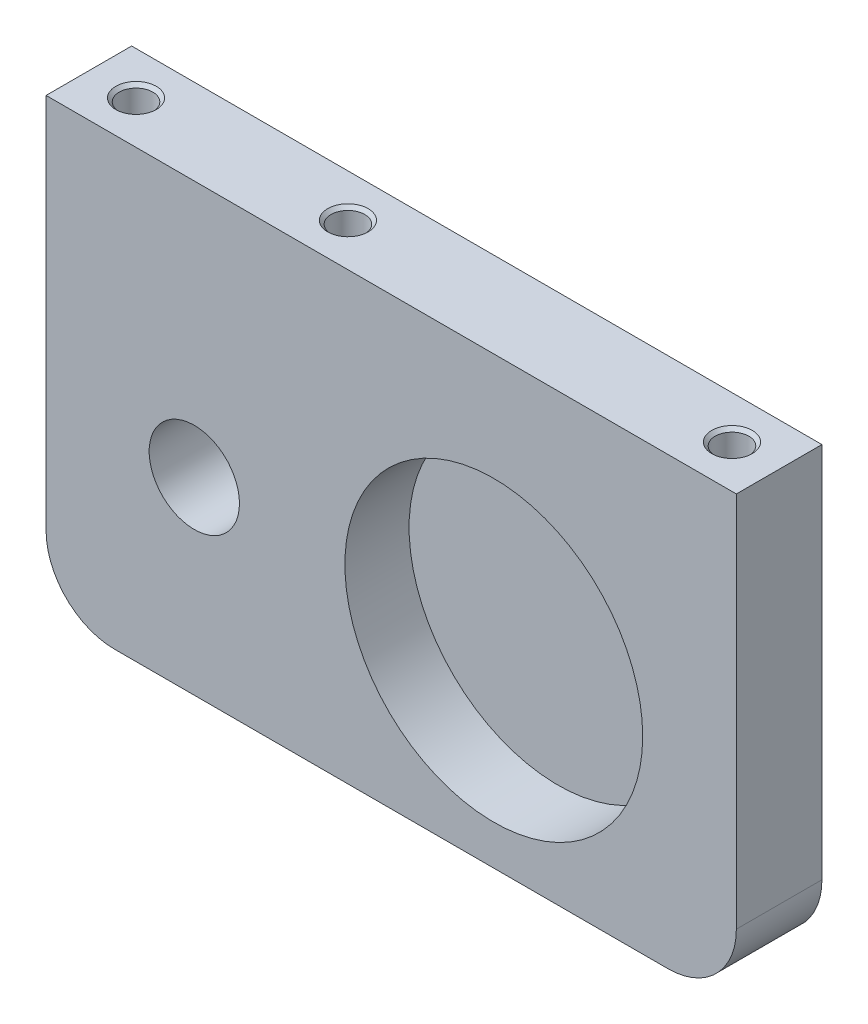
from build123d import *

# Parameters (mm, degrees)
SKETCH1_W           = 51.225
SKETCH1_H           = 33.05
BOSS_EXTRUDE1_DEPTH = 6.35
SKETCH8_R           = 1.25
CUT_EXTRUDE4_DEPTH  = 15
SKETCH10_R          = 3.35
SKETCH10_R_2        = 11.05
CUT_EXTRUDE5_DEPTH  = 4.7625
FILLET3_R           = 5.08
CHAMFER1_SIZE       = 0.25


with BuildPart() as part:
    # Sketch1 → Boss-Extrude1 (new body)
    with BuildSketch(Plane.XY):
        with Locations((-7.6125, 2.525)):
            Rectangle(SKETCH1_W, SKETCH1_H)
    extrude(amount=-BOSS_EXTRUDE1_DEPTH)

    # Sketch8 → Cut-Extrude4 (cut)
    with BuildSketch(Plane(origin=(0, 19.05, 0), x_dir=(1, 0, 0), z_dir=(0, 1, 0))):
        with Locations(Location((-29.725, 3.175, 0), (0, 0, 270))):
            Circle(SKETCH8_R)
        with Locations(Location((-14, 3.175, 0), (0, 0, 270))):
            Circle(SKETCH8_R)
        with Locations(Location((14.5, 3.175, 0), (0, 0, 270))):
            Circle(SKETCH8_R)
    extrude(amount=-CUT_EXTRUDE4_DEPTH, mode=Mode.SUBTRACT)

    # Sketch10 → Cut-Extrude5 (cut)
    with BuildSketch(Plane.XY):
        with Locations((-22.225, 0)):
            Circle(SKETCH10_R)
        Circle(SKETCH10_R_2)
    extrude(amount=-CUT_EXTRUDE5_DEPTH, mode=Mode.SUBTRACT)

    # Fillet3
    fillet3_edges = [part.edges().sort_by_distance(p)[0] for p in [
        (18, -14, -3.175),
        (-33.225, -14, -3.175),
    ]]
    fillet(fillet3_edges, radius=FILLET3_R)

    # Chamfer1
    chamfer1_edges = [part.edges().sort_by_distance(p)[0] for p in [
        (-29.725, 19.05, -4.425),
        (-14, 19.05, -4.425),
        (14.5, 19.05, -4.425),
    ]]
    chamfer(chamfer1_edges, length=CHAMFER1_SIZE)


solid = part.part
